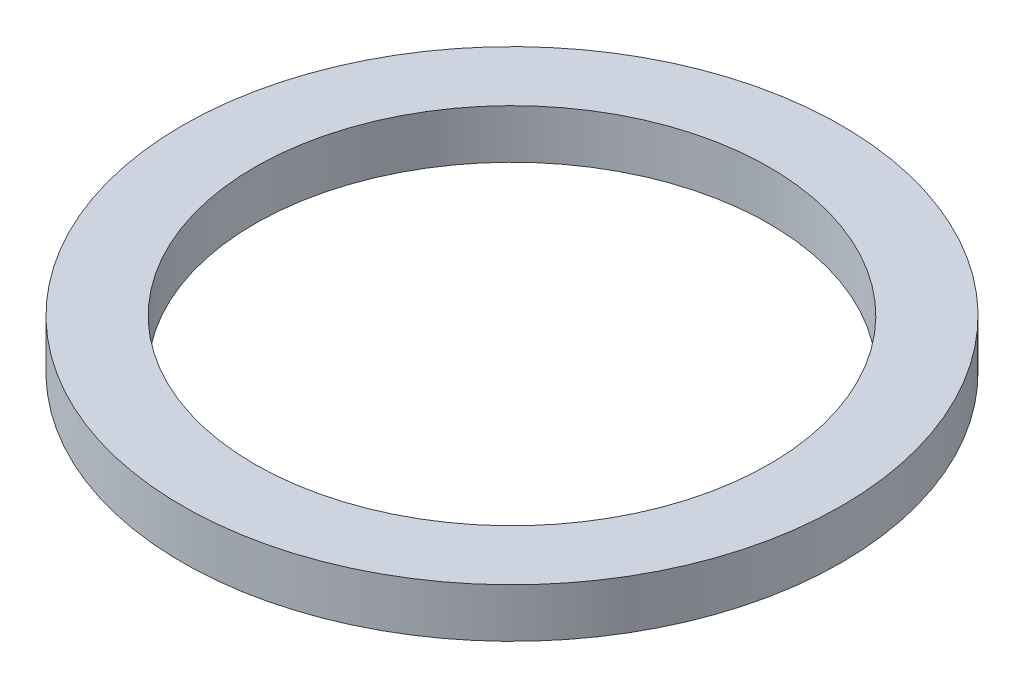
from build123d import *

# Parameters (mm, degrees)
SKETCH_1_R      = 13.45
SKETCH_1_R_2    = 10.5
EXTRUDE_1_DEPTH = 2


with BuildPart() as part:
    # 草圖1 → 伸長-薄件1 (new body)
    with BuildSketch(Plane(origin=(0, 0, 0), x_dir=(1, 0, 0), z_dir=(0, 1, 0))):
        Circle(SKETCH_1_R)
        Circle(SKETCH_1_R_2, mode=Mode.SUBTRACT)
    extrude(amount=EXTRUDE_1_DEPTH)


solid = part.part
